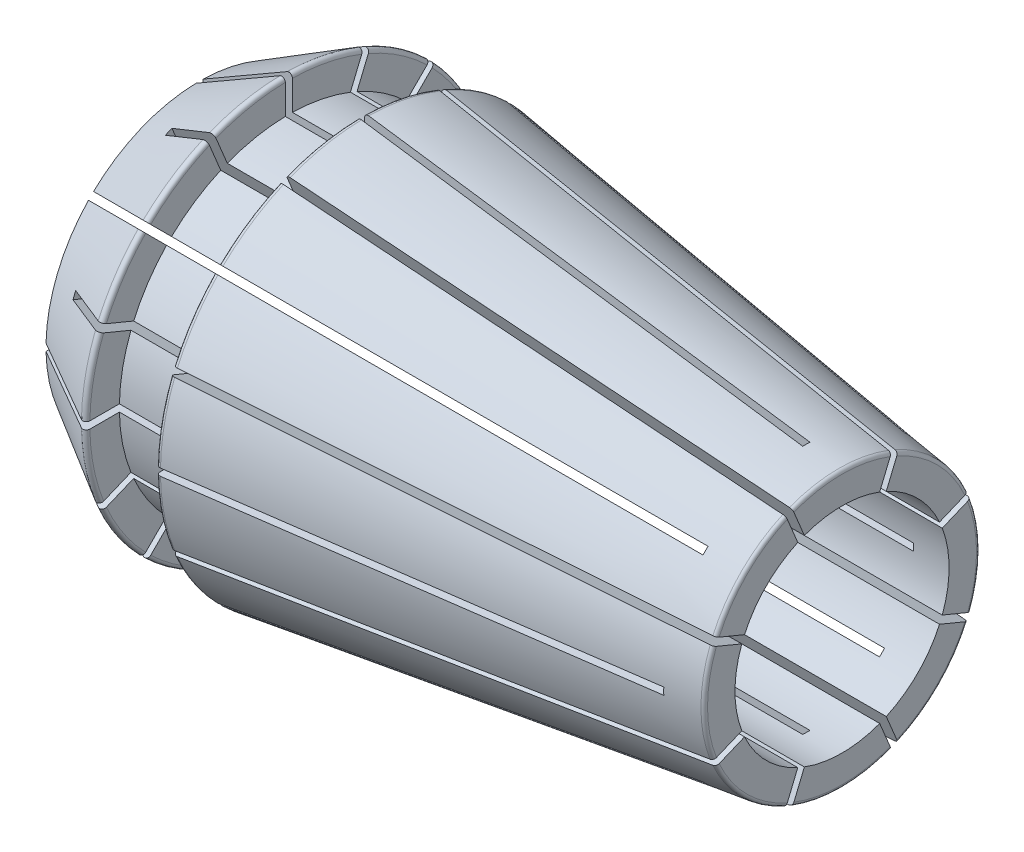
from build123d import *
from OCP.BRepFilletAPI import BRepFilletAPI_MakeChamfer

# Parameters (mm, degrees)
SKETCH2_R           = 5.75
BOSS_EXTRUDE1_DEPTH = 18
SKETCH3_W           = 18
SKETCH3_H           = 3
SKETCH4_W           = 0.2
SKETCH4_H           = 62
SKETCH4_W_2         = 62
SKETCH4_H_2         = 0.2
CUT_EXTRUDE1_DEPTH  = 17
CUT_EXTRUDE2_DEPTH  = 17
CHAMFER_1_SIZE      = 0.1
CHAMFER_1_SIZE2     = 0.173205081
FILLET_1_R          = 0.1


with BuildPart() as part:
    # Sketch2 → Boss-Extrude1 (new body)
    with BuildSketch(Plane(origin=(0, 0, 0), x_dir=(0, 0, -1), z_dir=(1, 0, 0))):
        Circle(SKETCH2_R)
    extrude(amount=BOSS_EXTRUDE1_DEPTH)

    # Sketch3 → Cut-Revolve1 (revolve, cut)
    with BuildSketch(Plane.XY, mode=Mode.PRIVATE) as cut_revolve1_sk:
        Polygon((0, 4.306624327), (2.5, 5.75), (2.5, 4.75), (4.521157569, 4.75), (4.521157569, 5.75), (18, 3.855672234), (18, 10.75), (0, 10.75), align=None)
        with Locations((9, 1.5)):
            Rectangle(SKETCH3_W, SKETCH3_H)
    revolve(cut_revolve1_sk.sketch.rotate(Axis((0, 0, 0), (1, 0, 0)), 90), axis=Axis((0, 0, 0), (1, 0, 0)), mode=Mode.SUBTRACT)

    # Sketch4 → Cut-Extrude1 (cut)
    with BuildSketch(Plane.ZY):
        Polygon((21.849599539, 21.991020895), (21.991020895, 21.849599539), (-21.849599539, -21.991020895), (-21.991020895, -21.849599539), align=None)
        Rectangle(SKETCH4_W, SKETCH4_H)
        Rectangle(SKETCH4_W_2, SKETCH4_H_2)
        Polygon((21.991020895, -21.849599539), (21.849599539, -21.991020895), (-21.991020895, 21.849599539), (-21.849599539, 21.991020895), align=None)
    extrude(amount=-CUT_EXTRUDE1_DEPTH, mode=Mode.SUBTRACT)

    # Sketch5 → Cut-Extrude2 (cut)
    with BuildSketch(Plane(origin=(18, 0, 0), x_dir=(0, 0, -1), z_dir=(1, 0, 0))):
        Polygon((-11.955574357, -28.601997165), (-11.77079845, -28.678533851), (11.955574357, 28.601997165), (11.77079845, 28.678533851), align=None)
        Polygon((28.601997165, 11.955574357), (28.678533851, 11.77079845), (-28.601997165, -11.955574357), (-28.678533851, -11.77079845), align=None)
        Polygon((28.678533851, -11.77079845), (28.601997165, -11.955574357), (-28.678533851, 11.77079845), (-28.601997165, 11.955574357), align=None)
        Polygon((11.955574357, -28.601997165), (11.77079845, -28.678533851), (-11.955574357, 28.601997165), (-11.77079845, 28.678533851), align=None)
    extrude(amount=-CUT_EXTRUDE2_DEPTH, mode=Mode.SUBTRACT)

    # Фаска1: one chamfer whose edges measure the first distance from different faces: ONE call of the kernel's chamfer builder (chamfer() names one face for all edges)
    chamfer_1_edges_1 = [part.edges().sort_by_distance(p)[0] for p in [
        (0, 2.771638598, 1.148050297),
    ]]
    chamfer_1_side_1 = [part.faces().sort_by_distance(p)[0] for p in [
        (0, 3.338332707, 1.382782683),
    ]]
    chamfer_1_edges_2 = [part.edges().sort_by_distance(p)[0] for p in [
        (0, 2.771638598, -1.148050297),
    ]]
    chamfer_1_side_2 = [part.faces().sort_by_distance(p)[0] for p in [
        (0, 3.338332707, -1.382782683),
    ]]
    chamfer_1_edges_3 = [part.edges().sort_by_distance(p)[0] for p in [
        (0, 1.148050297, -2.771638598),
    ]]
    chamfer_1_side_3 = [part.faces().sort_by_distance(p)[0] for p in [
        (0, 1.382782683, -3.338332707),
    ]]
    chamfer_1_edges_4 = [part.edges().sort_by_distance(p)[0] for p in [
        (0, -1.148050297, -2.771638598),
    ]]
    chamfer_1_side_4 = [part.faces().sort_by_distance(p)[0] for p in [
        (0, -1.382782683, -3.338332707),
    ]]
    chamfer_1_edges_5 = [part.edges().sort_by_distance(p)[0] for p in [
        (0, -2.771638598, -1.148050297),
    ]]
    chamfer_1_side_5 = [part.faces().sort_by_distance(p)[0] for p in [
        (0, -3.338332707, -1.382782683),
    ]]
    chamfer_1_edges_6 = [part.edges().sort_by_distance(p)[0] for p in [
        (0, -2.771638598, 1.148050297),
    ]]
    chamfer_1_side_6 = [part.faces().sort_by_distance(p)[0] for p in [
        (0, -3.338332707, 1.382782683),
    ]]
    chamfer_1_edges_7 = [part.edges().sort_by_distance(p)[0] for p in [
        (0, -1.148050297, 2.771638598),
    ]]
    chamfer_1_side_7 = [part.faces().sort_by_distance(p)[0] for p in [
        (0, -1.382782683, 3.338332707),
    ]]
    chamfer_1_edges_8 = [part.edges().sort_by_distance(p)[0] for p in [
        (0, 1.148050297, 2.771638598),
    ]]
    chamfer_1_side_8 = [part.faces().sort_by_distance(p)[0] for p in [
        (0, 1.382782683, 3.338332707),
    ]]
    chamfer_1 = BRepFilletAPI_MakeChamfer(part.part.solid().wrapped)
    for e in chamfer_1_edges_1:
        chamfer_1.Add(CHAMFER_1_SIZE, CHAMFER_1_SIZE2, e.wrapped, chamfer_1_side_1[0].wrapped)  # the first distance lies on this face
    for e in chamfer_1_edges_2:
        chamfer_1.Add(CHAMFER_1_SIZE, CHAMFER_1_SIZE2, e.wrapped, chamfer_1_side_2[0].wrapped)  # the first distance lies on this face
    for e in chamfer_1_edges_3:
        chamfer_1.Add(CHAMFER_1_SIZE, CHAMFER_1_SIZE2, e.wrapped, chamfer_1_side_3[0].wrapped)  # the first distance lies on this face
    for e in chamfer_1_edges_4:
        chamfer_1.Add(CHAMFER_1_SIZE, CHAMFER_1_SIZE2, e.wrapped, chamfer_1_side_4[0].wrapped)  # the first distance lies on this face
    for e in chamfer_1_edges_5:
        chamfer_1.Add(CHAMFER_1_SIZE, CHAMFER_1_SIZE2, e.wrapped, chamfer_1_side_5[0].wrapped)  # the first distance lies on this face
    for e in chamfer_1_edges_6:
        chamfer_1.Add(CHAMFER_1_SIZE, CHAMFER_1_SIZE2, e.wrapped, chamfer_1_side_6[0].wrapped)  # the first distance lies on this face
    for e in chamfer_1_edges_7:
        chamfer_1.Add(CHAMFER_1_SIZE, CHAMFER_1_SIZE2, e.wrapped, chamfer_1_side_7[0].wrapped)  # the first distance lies on this face
    for e in chamfer_1_edges_8:
        chamfer_1.Add(CHAMFER_1_SIZE, CHAMFER_1_SIZE2, e.wrapped, chamfer_1_side_8[0].wrapped)  # the first distance lies on this face
    add(Compound.cast(chamfer_1.Shape()), mode=Mode.REPLACE)

    # Скругление1
    fillet_1_edges = [part.edges().sort_by_distance(p)[0] for p in [
        (18, -2.726371983, -2.726371983),
        (18, 0, -3.855672234),
        (18, 2.726371983, -2.726371983),
        (18, 3.855672234, 0),
        (18, -3.855672234, 0),
        (18, -2.726371983, 2.726371983),
        (18, 0, 3.855672234),
        (18, 2.726371983, 2.726371983),
        (4.521157569, 1.121769352, -5.639515362),
        (4.521157569, 3.19452884, -4.780950271),
        (4.521157569, 4.780950271, -3.19452884),
        (2.5, 4.780950271, -3.19452884),
        (2.5, 3.19452884, -4.780950271),
        (2.5, 1.121769352, -5.639515362),
        (4.521157569, -4.780950271, -3.19452884),
        (4.521157569, -3.19452884, -4.780950271),
        (4.521157569, -1.121769352, -5.639515362),
        (2.5, -1.121769352, -5.639515362),
        (2.5, -3.19452884, -4.780950271),
        (2.5, -4.780950271, -3.19452884),
        (4.521157569, -5.639515362, -1.121769352),
        (2.5, -5.639515362, -1.121769352),
        (2.5, -5.639515362, 1.121769352),
        (4.521157569, -5.639515362, 1.121769352),
        (2.5, -4.780950271, 3.19452884),
        (2.5, -3.19452884, 4.780950271),
        (2.5, -1.121769352, 5.639515362),
        (4.521157569, -4.780950271, 3.19452884),
        (4.521157569, -3.19452884, 4.780950271),
        (4.521157569, -1.121769352, 5.639515362),
        (4.521157569, 1.121769352, 5.639515362),
        (2.5, 5.639515362, -1.121769352),
        (4.521157569, 5.639515362, -1.121769352),
        (4.521157569, 5.639515362, 1.121769352),
        (2.5, 5.639515362, 1.121769352),
        (2.5, 4.780950271, 3.19452884),
        (2.5, 1.121769352, 5.639515362),
        (2.5, 3.19452884, 4.780950271),
        (4.521157569, 4.780950271, 3.19452884),
        (4.521157569, 3.19452884, 4.780950271),
    ]]
    fillet(fillet_1_edges, radius=FILLET_1_R)


solid = part.part
